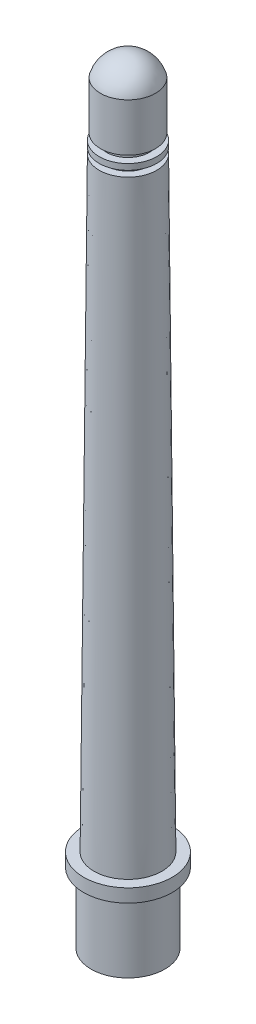
from build123d import *


with BuildPart() as part:
    # 草图1 → 旋转1 (revolve)
    with BuildSketch(Plane.XY, mode=Mode.PRIVATE) as revolve_1_sk:
        with BuildLine():
            Line((-5, -9.5), (-5, 0))
            Line((-5, 0), (-6, 0))
            Line((-6, 0), (-6, 1.8))
            Line((-6, 1.8), (-4.6, 1.8))
            Line((-4.6, 1.8), (-3.9, 83.8))
            Line((-3.9, 83.8), (-2.9, 83.8))
            Line((-2.9, 83.8), (-2.9, 84.6))
            Line((-2.9, 84.6), (-3.9, 84.6))
            Line((-3.9, 84.6), (-3.9, 85.4))
            Line((-3.9, 85.4), (-2.9, 85.4))
            Line((-2.9, 85.4), (-2.9, 86.258788541))
            Line((-2.9, 86.258788541), (-3.735091076, 86.258788541))
            Line((-3.735091076, 86.258788541), (-3.735091076, 92.758788541))
            ThreePointArc((-3.735091076, 92.758788541), (-2.342754752, 94.800693716), (0, 95.587762553))
            Line((0, 95.587762553), (0, -9.5))
            Line((0, -9.5), (-5, -9.5))
        make_face()
    revolve(revolve_1_sk.sketch.rotate(Axis((0, 100.774977187, 0), (0, -1, 0)), 270), axis=Axis((0, 100.774977187, 0), (0, -1, 0)))


solid = part.part
